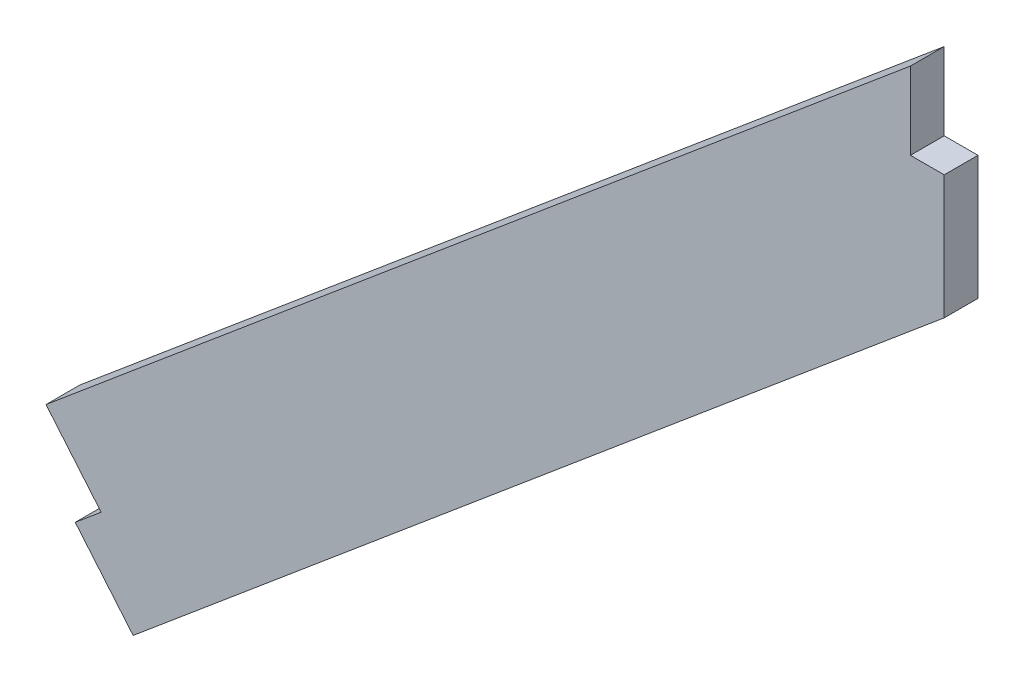
from build123d import *

# Parameters (mm, degrees)
SALIENTE_EXTRUIR1_DEPTH = 3


with BuildPart() as part:
    # Croquis1 → Saliente-Extruir1 (new body)
    with BuildSketch(Plane.XY):
        Polygon((0, -21.34), (-72.008177653, -81.762035311), (-77.150478531, -75.633679766), (-74.852345201, -73.705316937), (-79.745543249, -67.873830584), (-3, -3.476673549), (-3, -10.34), (0, -10.34), align=None)
    extrude(amount=SALIENTE_EXTRUIR1_DEPTH)


solid = part.part
